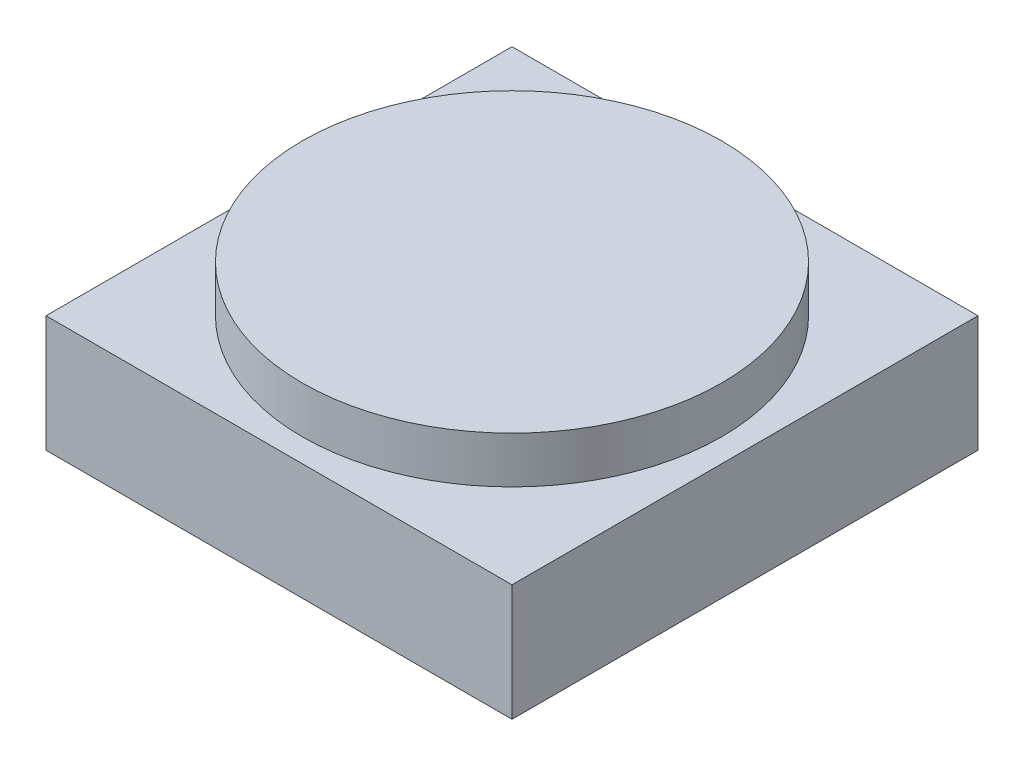
from build123d import *

# Parameters (mm, degrees)
SKETCH2_W           = 31.75
SKETCH2_H           = 31.75
BOSS_EXTRUDE1_DEPTH = 7.9375
SKETCH3_R           = 14.2875
BOSS_EXTRUDE2_DEPTH = 3.175


with BuildPart() as part:
    # Sketch2 → Boss-Extrude1 (new body)
    with BuildSketch(Plane(origin=(0, 0, 0), x_dir=(1, 0, 0), z_dir=(0, 1, 0))):
        Rectangle(SKETCH2_W, SKETCH2_H)
    extrude(amount=BOSS_EXTRUDE1_DEPTH)


with BuildPart() as body_2:
    # Sketch3 → Boss-Extrude2 (new body)
    with BuildSketch(Plane(origin=(0, 7.9375, 0), x_dir=(1, 0, 0), z_dir=(0, 1, 0))):
        with Locations(Location((0, 0, 0), (0, 0, 270))):
            Circle(SKETCH3_R)
    extrude(amount=BOSS_EXTRUDE2_DEPTH)


solid = Compound([part.part, body_2.part])
